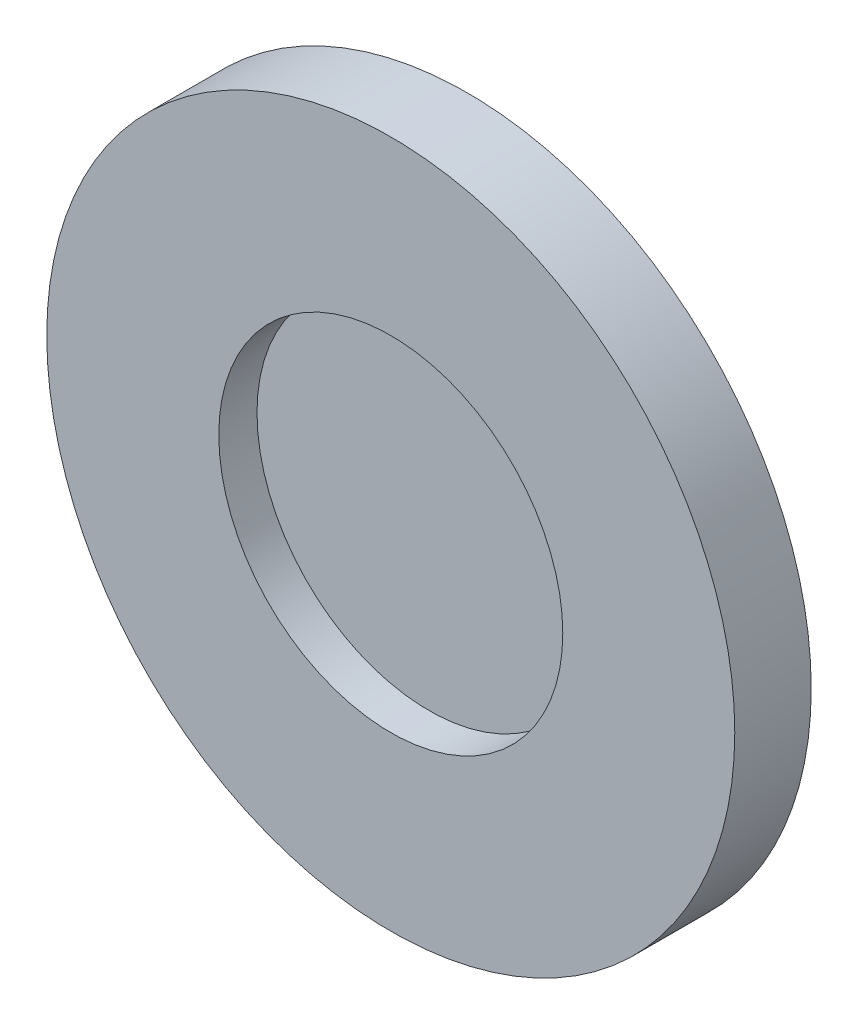
from build123d import *

# Parameters (mm, degrees)
IZIM1_R                     = 90
Y_KSEKLIK_EKSTR_ZYON1_DEPTH = 10
IZIM2_R                     = 90
IZIM2_R_2                   = 45
Y_KSEKLIK_EKSTR_ZYON2_DEPTH = 10


with BuildPart() as part:
    # Çizim1 → Yükseklik-Ekstrüzyon1 (new body)
    with BuildSketch(Plane.XY):
        Circle(IZIM1_R)
    extrude(amount=Y_KSEKLIK_EKSTR_ZYON1_DEPTH)

    # Çizim2 → Yükseklik-Ekstrüzyon2 (add)
    with BuildSketch(Plane.XY.offset(10)):
        Circle(IZIM2_R)
        Circle(IZIM2_R_2, mode=Mode.SUBTRACT)
    extrude(amount=Y_KSEKLIK_EKSTR_ZYON2_DEPTH)


solid = part.part
